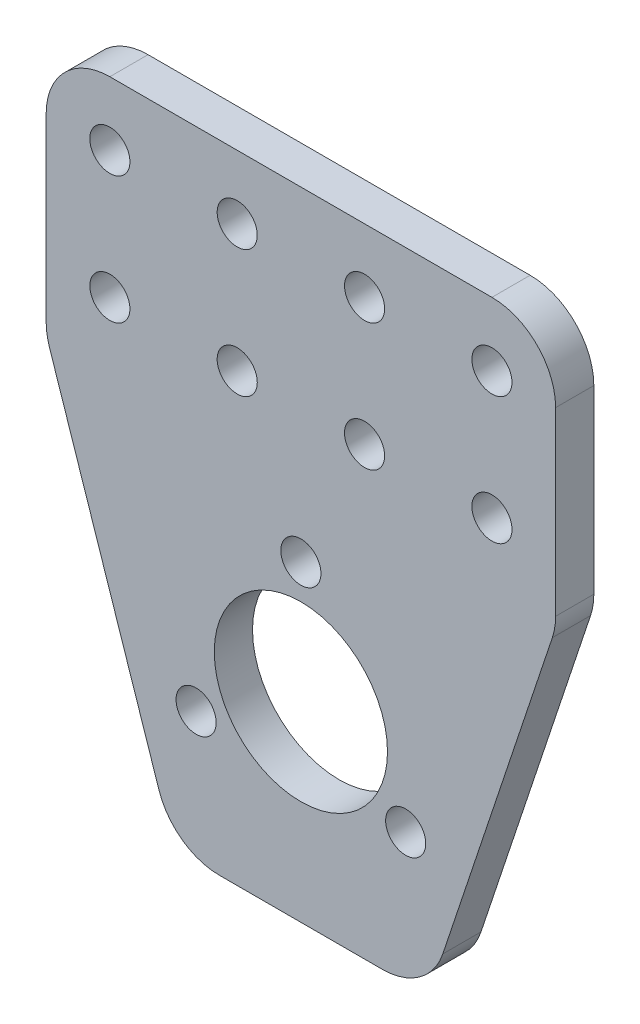
from build123d import *

# Parameters (mm, degrees)
EXTRUDE_1_DEPTH     = 3
SKETCH_2_R          = 1.575
SKETCH_2_R_2        = 6.8
CUT_EXTRUDE_2_DEPTH = 65.101482042
FILLET_1_R          = 5


with BuildPart() as part:
    # 草图1 → 凸台-拉伸1 (new body)
    with BuildSketch(Plane.XY):
        Polygon((0, 0), (0, -20), (10, -50), (30, -50), (40, -20), (40, 0), align=None)
    extrude(amount=EXTRUDE_1_DEPTH)

    # 草图2 → 切除-拉伸2 (cut, through all)
    with BuildSketch(Plane.XY.offset(3)):
        with Locations((5, -5)):
            Circle(SKETCH_2_R)
        with Locations(Location((15, -5, 0), (0, 0, 180))):
            Circle(SKETCH_2_R)
        with Locations((15, -15)):
            Circle(SKETCH_2_R)
        with Locations(Location((5, -15, 0), (0, 0, 180))):
            Circle(SKETCH_2_R)
        with Locations((35, -15)):
            Circle(SKETCH_2_R)
        with Locations(Location((25, -15, 0), (0, 0, 180))):
            Circle(SKETCH_2_R)
        with Locations((25, -5)):
            Circle(SKETCH_2_R)
        with Locations(Location((35, -5, 0), (0, 0, 180))):
            Circle(SKETCH_2_R)
        with Locations((20, -35)):
            Circle(SKETCH_2_R_2)
        with Locations((20, -25.5)):
            Circle(SKETCH_2_R)
        with Locations((28.227241336, -39.75)):
            Circle(SKETCH_2_R)
        with Locations((11.772758664, -39.75)):
            Circle(SKETCH_2_R)
    extrude(amount=-CUT_EXTRUDE_2_DEPTH, mode=Mode.SUBTRACT)

    # 圆角1
    fillet_1_edges = [part.edges().sort_by_distance(p)[0] for p in [
        (40, 0, 1.5),
        (40, -20, 1.5),
        (30, -50, 1.5),
        (10, -50, 1.5),
        (0, -20, 1.5),
        (0, 0, 1.5),
    ]]
    fillet(fillet_1_edges, radius=FILLET_1_R)


solid = part.part
